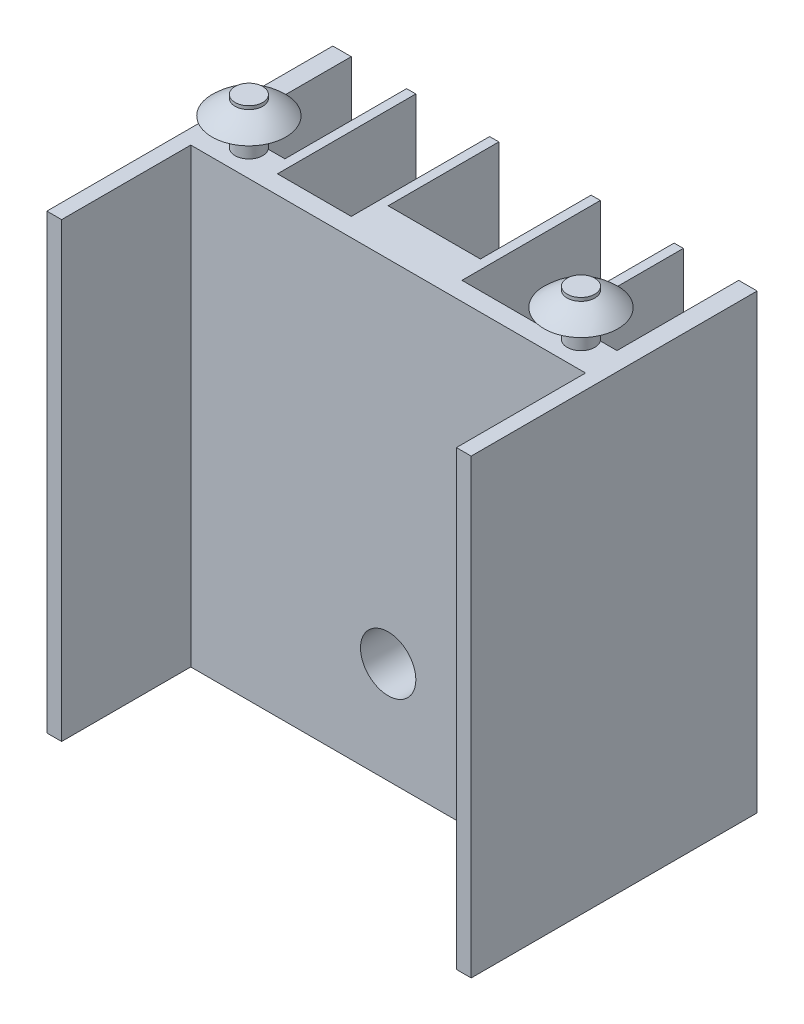
from build123d import *

# Parameters (mm, degrees)
IZIM1_W                          = 23
IZIM1_H                          = 15.5
Y_KSEKLIK_EKSTR_ZYON1_DEPTH      = 24.5
IZIM2_W                          = 21.4
IZIM2_H                          = 7
IZIM2_W_2                        = 5
IZIM2_H_2                        = 6
IZIM2_W_3                        = 4
IZIM2_H_3                        = 7.5
KES_EKSTR_ZYON1_DEPTH            = 24.5
Y_KSEKLIK_EKSTR_ZYON4_DEPTH      = 2.5
Y_KSEKLIK_EKSTR_ZYON4_DEPTH_BACK = 10
IZIM3_R                          = 0.75
IZIM8_R                          = 1.5
KES_EKSTR_ZYON3_DEPTH            = 10


with BuildPart() as part:
    # Çizim1 → Yükseklik-Ekstrüzyon1 (new body)
    with BuildSketch(Plane(origin=(0, 0, 0), x_dir=(1, 0, 0), z_dir=(0, 1, 0))):
        Rectangle(IZIM1_W, IZIM1_H)
    extrude(amount=Y_KSEKLIK_EKSTR_ZYON1_DEPTH)

    # Çizim2 → Kes-Ekstrüzyon1 (cut)
    with BuildSketch(Plane(origin=(0, 0, 0), x_dir=(1, 0, 0), z_dir=(0, 1, 0))):
        with Locations((0, -4.25)):
            Rectangle(IZIM2_W, IZIM2_H)
        Polygon((-8.5, 1.153663729), (-7.5, 1.153663729), (-7.5, 7.75), (-10.5, 7.75), (-10.5, 1.153663729), (-9.5, 1.153663729), (-9.5, 0.25), (-8.5, 0.25), align=None)
        with Locations((0, 4.75)):
            Rectangle(IZIM2_W_2, IZIM2_H_2)
        with Locations((-5, 4)):
            Rectangle(IZIM2_W_3, IZIM2_H_3)
        with Locations((5, 4)):
            Rectangle(IZIM2_W_3, IZIM2_H_3)
        Polygon((10.5, 7.75), (7.5, 7.75), (7.5, 1.153663729), (8.5, 1.153663729), (8.5, 0.25), (9.5, 0.25), (9.5, 1.153663729), (10.5, 1.153663729), align=None)
    extrude(amount=KES_EKSTR_ZYON1_DEPTH, mode=Mode.SUBTRACT)

    # Çizim3 → Yükseklik-Ekstrüzyon4 (add, two sides: drawn at the far end of the back side and taken through both)
    with BuildSketch(Plane(origin=(0, 24.5, 0), x_dir=(1, 0, 0), z_dir=(0, 1, 0)).offset(-Y_KSEKLIK_EKSTR_ZYON4_DEPTH_BACK)):
        with Locations(Location((-9, 0.701831864, 0), (0, 0, 270))):
            Circle(IZIM3_R)
        with Locations(Location((9, 0.701831864, 0), (0, 0, 142.95497119))):
            Circle(IZIM3_R)
    extrude(amount=Y_KSEKLIK_EKSTR_ZYON4_DEPTH + Y_KSEKLIK_EKSTR_ZYON4_DEPTH_BACK)

    # Çizim5 → Döndür2 (revolve)
    with BuildSketch(Plane.ZY.offset(9), mode=Mode.PRIVATE) as d_nd_r2_sk:
        with BuildLine():
            Line((-2.701831864, 26), (-0.701831864, 26))
            Line((-0.701831864, 26), (-0.701831864, 27))
            add(Edge.make_bspline(
                [(-2.701831864, 26), (-1.790219679, 26.874416791), (-0.701831864, 27)],
                knots=[0, 0, 0, 0.748833581, 0.748833581, 0.748833581], degree=2))
        make_face()
    revolve(d_nd_r2_sk.sketch.rotate(Axis((-9, 26, -0.701831864), (0, 1, 0)), 180), axis=Axis((-9, 26, -0.701831864), (0, 1, 0)))

    # Çizim6 → Döndür3 (revolve)
    with BuildSketch(Plane(origin=(9, 0, 0), x_dir=(0, 0, -1), z_dir=(1, 0, 0)), mode=Mode.PRIVATE) as d_nd_r3_sk:
        with BuildLine():
            Line((-1.298168136, 26), (0.701831864, 26.01043139))
            Line((0.701831864, 26.01043139), (0.701831864, 27))
            add(Edge.make_bspline(
                [(-1.298168136, 26), (-0.38655595, 26.874416791), (0.701831864, 27)],
                knots=[0, 0, 0, 0.748833581, 0.748833581, 0.748833581], degree=2))
        make_face()
    revolve(d_nd_r3_sk.sketch.rotate(Axis((9, 26.01043139, -0.701831864), (0, 1, 0)), 180), axis=Axis((9, 26.01043139, -0.701831864), (0, 1, 0)))

    # Çizim8 → Kes-Ekstrüzyon3 (cut)
    with BuildSketch(Plane.XY.offset(0.75)):
        with Locations((0, 5.5)):
            Circle(IZIM8_R)
    extrude(amount=-KES_EKSTR_ZYON3_DEPTH, mode=Mode.SUBTRACT)


solid = part.part
